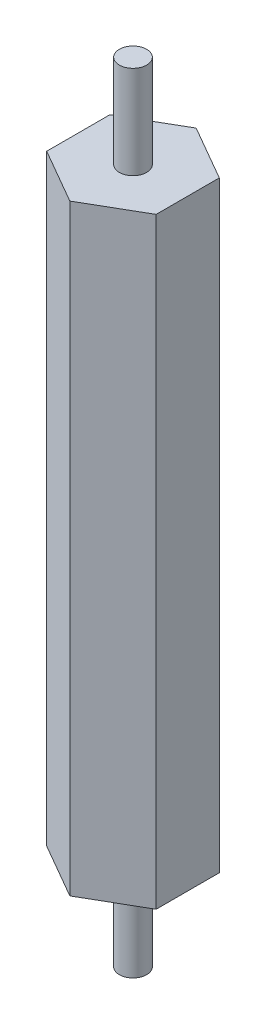
from build123d import *

# Parameters (mm, degrees)
EXTRUDE_1_DEPTH = 110
SKETCH_3_R      = 2.5
EXTRUDE_2_DEPTH = 17
EXTRUDE_START   = 17
SKETCH_4_R      = 2.5
EXTRUDE_3_DEPTH = 17


with BuildPart() as part:
    # ｽｹｯﾁ1 → ﾎﾞｽ - 押し出し1 (new body)
    with BuildSketch(Plane(origin=(0, 0, 0), x_dir=(1, 0, 0), z_dir=(0, 1, 0))):
        Polygon((10.001849625, -5.770297861), (9.998149348, 5.77670693), (-0.003700278, 11.547004791), (-10.001849625, 5.770297861), (-9.998149348, -5.77670693), (0.003700278, -11.547004791), align=None)
    extrude(amount=EXTRUDE_1_DEPTH)

    # ｽｹｯﾁ3 → ﾎﾞｽ - 押し出し2 (add)
    with BuildSketch(Plane(origin=(0, 110, 0), x_dir=(1, 0, 0), z_dir=(0, 1, 0))):
        with Locations(Location((0, 0, 0), (0, 0, 270))):
            Circle(SKETCH_3_R)
    extrude(amount=EXTRUDE_2_DEPTH)

    # ｽｹｯﾁ4 → ﾎﾞｽ - 押し出し3 (add)
    with BuildSketch(Plane.XZ.offset(EXTRUDE_START)):
        with Locations(Location((0, 0, 0), (0, 0, 90))):
            Circle(SKETCH_4_R)
    extrude(amount=-EXTRUDE_3_DEPTH)


solid = part.part
